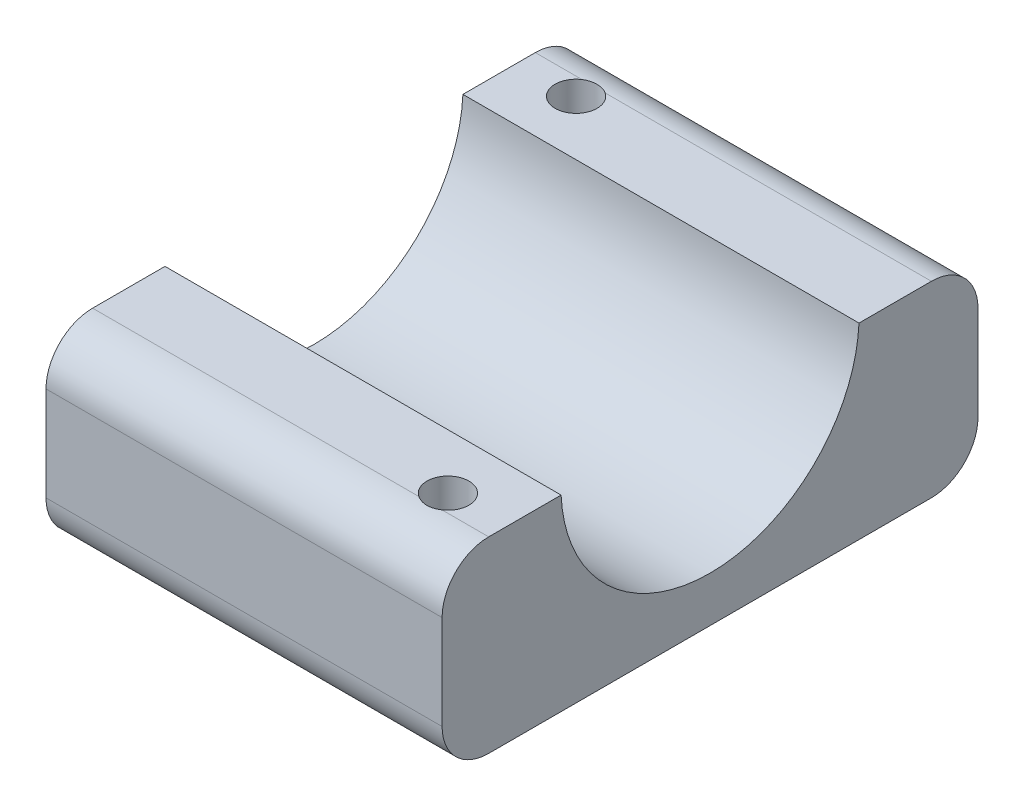
from build123d import *

# Parameters (mm, degrees)
BOSS_EXTRUDE1_DEPTH     = 17
CUT_EXTRUDE1_DEPTH      = 34.119329703
CUT_EXTRUDE1_DEPTH_BACK = 34.119329703
SKETCH2_R               = 12.8
SKETCH3_R               = 1.8
CUT_EXTRUDE2_DEPTH      = 17
SKETCH4_R               = 3.25
CUT_EXTRUDE3_DEPTH      = 7.5


with BuildPart() as part:
    # Sketch1 → Boss-Extrude1 (new, symmetric)
    with BuildSketch(Plane(origin=(0, 0, 0), x_dir=(0, 0, -1), z_dir=(1, 0, 0))):
        with BuildLine():
            Line((-19, -16.7), (19, -16.7))
            ThreePointArc((19, -16.7), (21.828427125, -15.528427125), (23, -12.7))
            Line((23, -12.7), (23, -4.6))
            ThreePointArc((23, -4.6), (21.828427125, -1.771572875), (19, -0.6))
            Line((19, -0.6), (-19, -0.6))
            ThreePointArc((-19, -0.6), (-21.828427125, -1.771572875), (-23, -4.6))
            Line((-23, -4.6), (-23, -12.7))
            ThreePointArc((-23, -12.7), (-21.828427125, -15.528427125), (-19, -16.7))
        make_face()
    extrude(amount=BOSS_EXTRUDE1_DEPTH, both=True)

    # Sketch2 → Cut-Extrude1 (cut, two sides: drawn at the far end of the back side and taken through both)
    with BuildSketch(Plane(origin=(0, 0, 0), x_dir=(0, 0, -1), z_dir=(1, 0, 0)).offset(-CUT_EXTRUDE1_DEPTH_BACK)):
        Circle(SKETCH2_R)
    extrude(amount=CUT_EXTRUDE1_DEPTH + CUT_EXTRUDE1_DEPTH_BACK, mode=Mode.SUBTRACT)

    # Sketch3 → Cut-Extrude2 (cut)
    with BuildSketch(Plane(origin=(0, -16.7, 0), x_dir=(1, 0, 0), z_dir=(0, 1, 0))):
        with Locations(Location((12, -17.5, 0), (0, 0, 236.442690238))):
            Circle(SKETCH3_R)
        with Locations(Location((-12, 17.5, 0), (0, 0, 56.442690238))):
            Circle(SKETCH3_R)
    extrude(amount=CUT_EXTRUDE2_DEPTH, mode=Mode.SUBTRACT)

    # Sketch4 → Cut-Extrude3 (cut)
    with BuildSketch(Plane(origin=(0, -16.7, 0), x_dir=(1, 0, 0), z_dir=(0, 1, 0))):
        with Locations(Location((12, -17.5, 0), (0, 0, 207.48642625))):
            Circle(SKETCH4_R)
        with Locations(Location((-12, 17.5, 0), (0, 0, 27.48642625))):
            Circle(SKETCH4_R)
    extrude(amount=CUT_EXTRUDE3_DEPTH, mode=Mode.SUBTRACT)


solid = part.part
